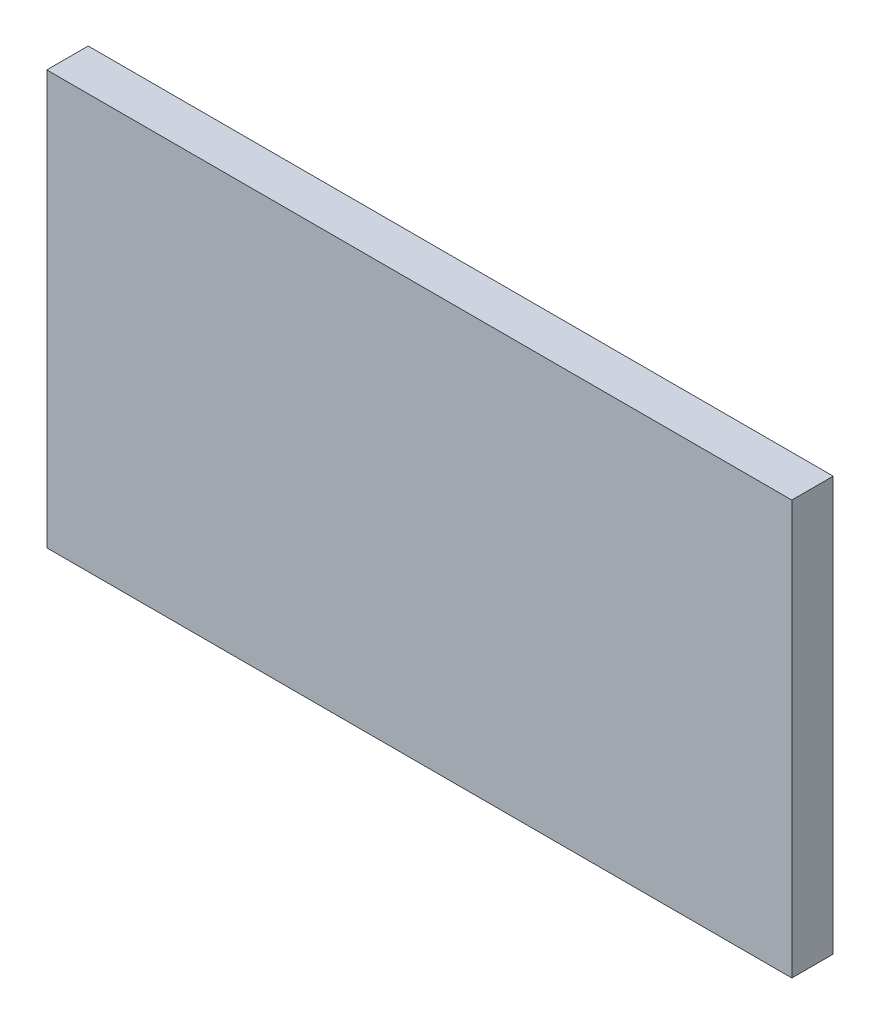
from build123d import *

# Parameters (mm, degrees)
SKETCH1_W           = 114.3
SKETCH1_H           = 63.5
BOSS_EXTRUDE1_DEPTH = 6.35


with BuildPart() as part:
    # Sketch1 → Boss-Extrude1 (new body)
    with BuildSketch(Plane.XY):
        with Locations((0, 31.75)):
            Rectangle(SKETCH1_W, SKETCH1_H)
    extrude(amount=BOSS_EXTRUDE1_DEPTH)


solid = part.part
